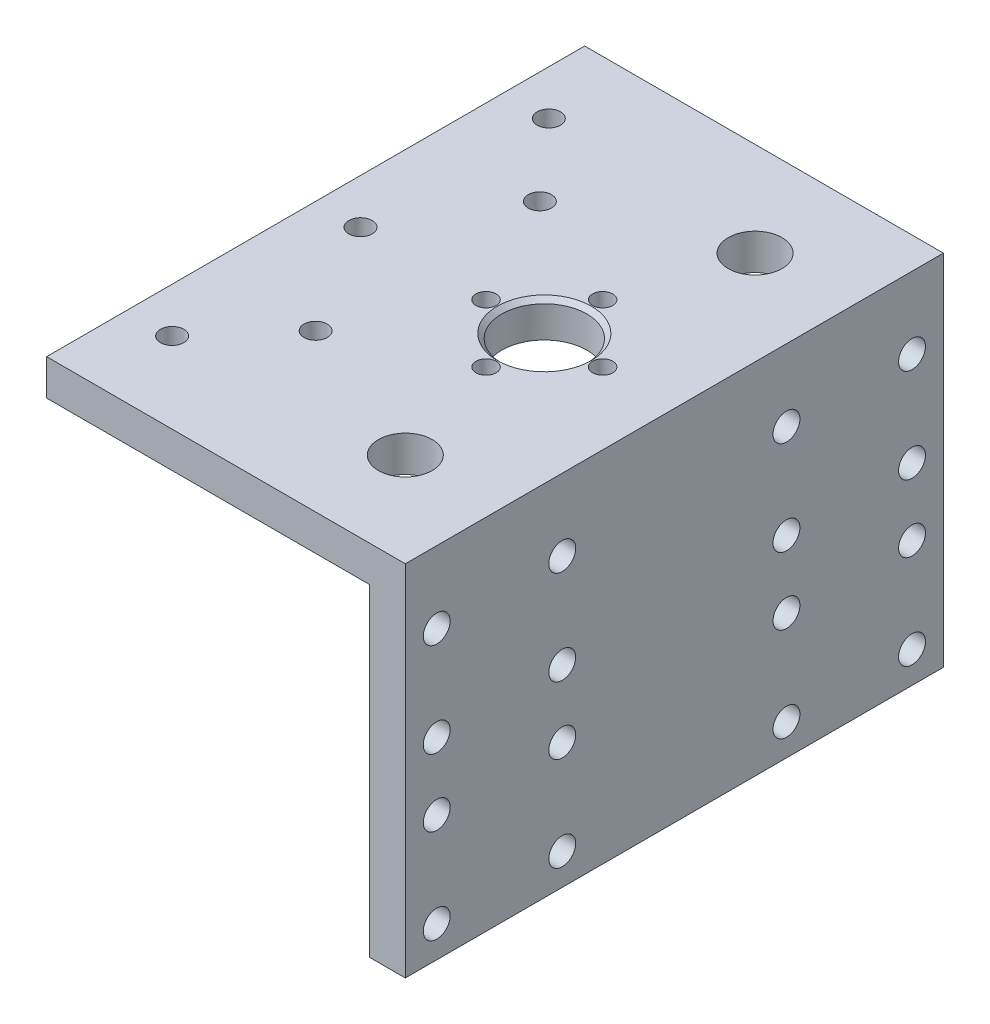
from build123d import *

# Parameters (mm, degrees)
ESTRUSIONE_ESTRUSIONE1_DEPTH = 120
TAGLIO_ESTRUSIONE2_REACH     = 166.924
SCHIZZO6_R                   = 6
TAGLIO_ESTRUSIONE3_REACH     = 166.924
SCHIZZO7_R                   = 9.5
FORO_PER_VITE_M4_2_D         = 4.5
SCHIZZO12_R                  = 3
TAGLIO_ESTRUSIONE4_DEPTH     = 10
SCHIZZO14_R                  = 2.6
TAGLIO_ESTRUSIONE5_DEPTH     = 10
SMUSSO2_SIZE                 = 1


with BuildPart() as part:
    # Schizzo1 → Estrusione-Estrusione1 (new body)
    with BuildSketch(Plane.XY):
        Polygon((0, 0), (-80, 0), (-80, -8), (-8, -8), (-8, -80), (0, -80), align=None)
    extrude(amount=ESTRUSIONE_ESTRUSIONE1_DEPTH)

    # Schizzo6 → Taglio-Estrusione2 (cut, up to next)
    with BuildSketch(Plane(origin=(0, 0, 0), x_dir=(1, 0, 0), z_dir=(0, 1, 0)), mode=Mode.PRIVATE) as taglio_estrusione2_sk1:
        with Locations(Location((-21, -21, 0), (0, 0, 180))):
            Circle(SCHIZZO6_R)
    taglio_estrusione2_tool1 = extrude(taglio_estrusione2_sk1.sketch, amount=-TAGLIO_ESTRUSIONE2_REACH, mode=Mode.PRIVATE) & part.part
    # Schizzo6 → Taglio-Estrusione2 (cut, up to next)
    with BuildSketch(Plane(origin=(0, 0, 0), x_dir=(1, 0, 0), z_dir=(0, 1, 0)), mode=Mode.PRIVATE) as taglio_estrusione2_sk2:
        with Locations(Location((-21, -99, 0), (0, 0, 180))):
            Circle(SCHIZZO6_R)
    taglio_estrusione2_tool2 = extrude(taglio_estrusione2_sk2.sketch, amount=-TAGLIO_ESTRUSIONE2_REACH, mode=Mode.PRIVATE) & part.part
    add(taglio_estrusione2_tool1.solids().sort_by_distance((-21, 0, 21))[0], mode=Mode.SUBTRACT)
    add(taglio_estrusione2_tool2.solids().sort_by_distance((-21, 0, 99))[0], mode=Mode.SUBTRACT)

    # Schizzo7 → Taglio-Estrusione3 (cut, up to next)
    with BuildSketch(Plane(origin=(0, 0, 0), x_dir=(1, 0, 0), z_dir=(0, 1, 0)), mode=Mode.PRIVATE) as taglio_estrusione3_sk1:
        with Locations(Location((-29, -60, 0), (0, 0, 180))):
            Circle(SCHIZZO7_R)
    taglio_estrusione3_tool1 = extrude(taglio_estrusione3_sk1.sketch, amount=-TAGLIO_ESTRUSIONE3_REACH, mode=Mode.PRIVATE) & part.part
    add(taglio_estrusione3_tool1.solids().sort_by_distance((-29, 0, 60))[0], mode=Mode.SUBTRACT)

    # Foro per Vite M4-2 (through all)
    with Locations(Plane(origin=(0, 0, 0), x_dir=(1, 0, 0), z_dir=(0, 1, 0))):
        with Locations((-29, -47), (-42, -60), (-29, -73), (-16, -60), (-29, -60)):
            Hole(FORO_PER_VITE_M4_2_D / 2)

    # Schizzo12 → Taglio-Estrusione4 (cut)
    with BuildSketch(Plane(origin=(0, 0, 0), x_dir=(0, 0, -1), z_dir=(1, 0, 0))):
        with Locations((-35, -73)):
            Circle(SCHIZZO12_R)
        with Locations(Location((-7, -73, 0), (0, 0, 90))):
            Circle(SCHIZZO12_R)
        with Locations((-113, -73)):
            Circle(SCHIZZO12_R)
        with Locations(Location((-85, -73, 0), (0, 0, 90))):
            Circle(SCHIZZO12_R)
        with Locations((-85, -52)):
            Circle(SCHIZZO12_R)
        with Locations(Location((-113, -52, 0), (0, 0, 90))):
            Circle(SCHIZZO12_R)
        with Locations(Location((-35, -52, 0), (0, 0, 90))):
            Circle(SCHIZZO12_R)
        with Locations((-7, -52)):
            Circle(SCHIZZO12_R)
        with Locations((-85, -16)):
            Circle(SCHIZZO12_R)
        with Locations(Location((-113, -16, 0), (0, 0, 90))):
            Circle(SCHIZZO12_R)
        with Locations((-35, -37)):
            Circle(SCHIZZO12_R)
        with Locations(Location((-7, -37, 0), (0, 0, 90))):
            Circle(SCHIZZO12_R)
        with Locations(Location((-35, -16, 0), (0, 0, 90))):
            Circle(SCHIZZO12_R)
        with Locations((-7, -16)):
            Circle(SCHIZZO12_R)
        with Locations(Location((-85, -37, 0), (0, 0, 90))):
            Circle(SCHIZZO12_R)
        with Locations((-113, -37)):
            Circle(SCHIZZO12_R)
    extrude(amount=-TAGLIO_ESTRUSIONE4_DEPTH, mode=Mode.SUBTRACT)

    # Schizzo14 → Taglio-Estrusione5 (cut)
    with BuildSketch(Plane(origin=(0, 0, 0), x_dir=(1, 0, 0), z_dir=(0, 1, 0))):
        with Locations(Location((-70, -18, 0), (0, 0, 180))):
            Circle(SCHIZZO14_R)
        with Locations(Location((-70, -60, 0), (0, 0, 180))):
            Circle(SCHIZZO14_R)
        with Locations(Location((-70, -102, 0), (0, 0, 180))):
            Circle(SCHIZZO14_R)
        with Locations(Location((-55, -35, 0), (0, 0, 180))):
            Circle(SCHIZZO14_R)
        with Locations(Location((-55, -85, 0), (0, 0, 180))):
            Circle(SCHIZZO14_R)
    extrude(amount=-TAGLIO_ESTRUSIONE5_DEPTH, mode=Mode.SUBTRACT)

    # Smusso2
    smusso2_edges = [part.edges().sort_by_distance(p)[0] for p in [
        (-19.5, 0, 60),
    ]]
    chamfer(smusso2_edges, length=SMUSSO2_SIZE)


solid = part.part
